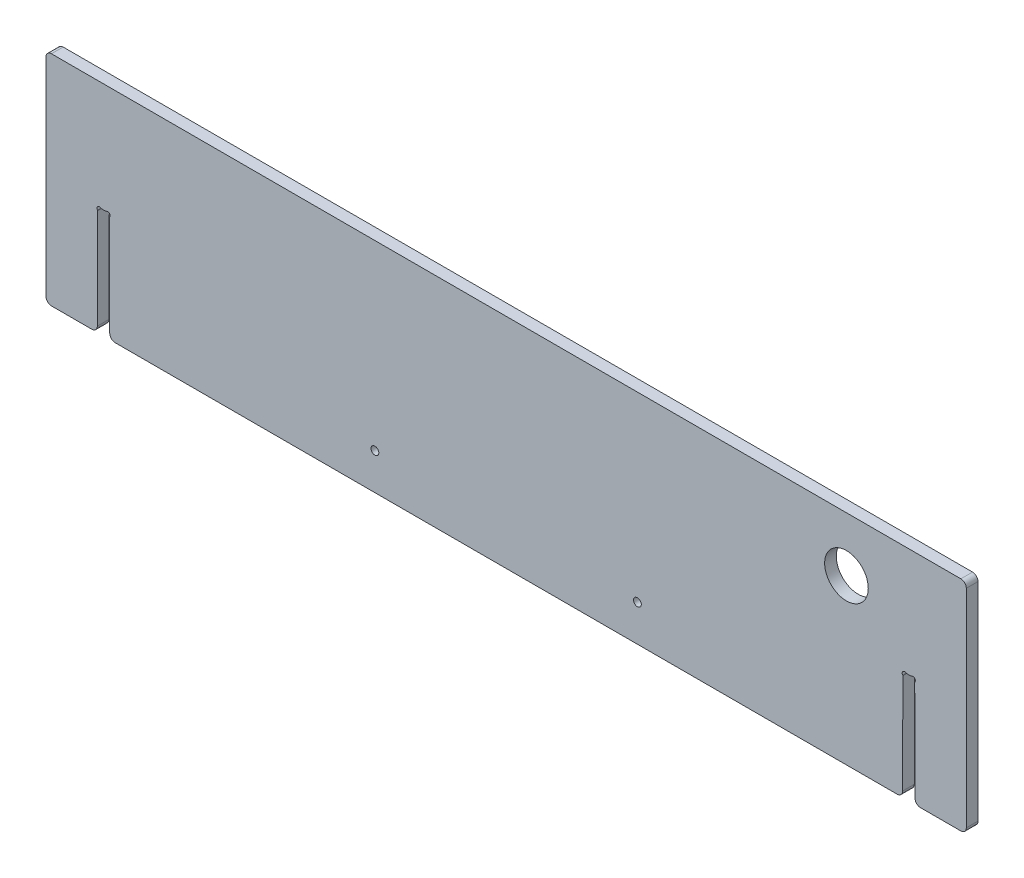
from build123d import *

# Parameters (mm, degrees)
ESQUISSE1_W         = 590.5
ESQUISSE1_H         = 280.25
BOSS_EXTRUDE1_DEPTH = 15
CUT_EXTRUDE1_DEPTH  = 654.800667253
ESQUISSE3_R         = 5
CUT_EXTRUDE2_DEPTH  = 654.800667253
CONG_1_R            = 7
SKETCH1_R           = 28
CUT_EXTRUDE3_DEPTH  = 1214.888818014


with BuildPart() as part:
    # Esquisse1 → Boss-Extrude1 (new body)
    with BuildSketch(Plane.XY):
        with Locations((295.25, 140.125)):
            Rectangle(ESQUISSE1_W, ESQUISSE1_H)
    extrude(amount=BOSS_EXTRUDE1_DEPTH)

    # Esquisse2 → Cut-Extrude1 (cut, through all)
    with BuildSketch(Plane.XY.offset(15)):
        with BuildLine():
            Line((70.977649355, 140.125), (76.647350645, 140.125))
            ThreePointArc((76.647350645, 140.125), (76.980108702, 140.181987765), (77.274940482, 140.346455848))
            ThreePointArc((77.274940482, 140.346455848), (81.406698158, 140.130786526), (81.644207297, 136.00022674))
            ThreePointArc((81.644207297, 136.00022674), (81.481699427, 135.705678195), (81.426062442, 135.373906919))
            Line((81.426062442, 135.373906919), (81.8125, 0))
            Line((81.8125, 0), (65.8125, 0))
            Line((65.8125, 0), (66.198937558, 135.373906919))
            ThreePointArc((66.198937558, 135.373906919), (66.143300573, 135.705678195), (65.980792703, 136.00022674))
            ThreePointArc((65.980792703, 136.00022674), (66.218301842, 140.130786526), (70.350059518, 140.346455848))
            ThreePointArc((70.350059518, 140.346455848), (70.644891298, 140.181987765), (70.977649355, 140.125))
        make_face()
    extrude(amount=-CUT_EXTRUDE1_DEPTH, mode=Mode.SUBTRACT)

    # Esquisse3 → Cut-Extrude2 (cut, through all)
    with BuildSketch(Plane.XY.offset(15)):
        with Locations((422.0625, 46.708333333)):
            Circle(ESQUISSE3_R)
    extrude(amount=-CUT_EXTRUDE2_DEPTH, mode=Mode.SUBTRACT)

    # Congé1
    cong_1_edges = [part.edges().sort_by_distance(p)[0] for p in [
        (81.8125, 0, 7.5),
        (65.8125, 0, 7.5),
        (0, 0, 7.5),
        (0, 280.25, 7.5),
    ]]
    fillet(cong_1_edges, radius=CONG_1_R)

    # Symétrie1: part across plane


with BuildPart() as part_1:
    add(part.part)
    add(part.part.mirror(Plane(origin=(590.5, 0, 15), x_dir=(0, 0, 1), z_dir=(-1, 0, 0))))

    # Sketch1 → Cut-Extrude3 (cut, through all)
    with BuildSketch(Plane.XY.offset(15)):
        with Locations((1027.1875, 210.25)):
            Circle(SKETCH1_R)
    extrude(amount=-CUT_EXTRUDE3_DEPTH, mode=Mode.SUBTRACT)


solid = part_1.part
